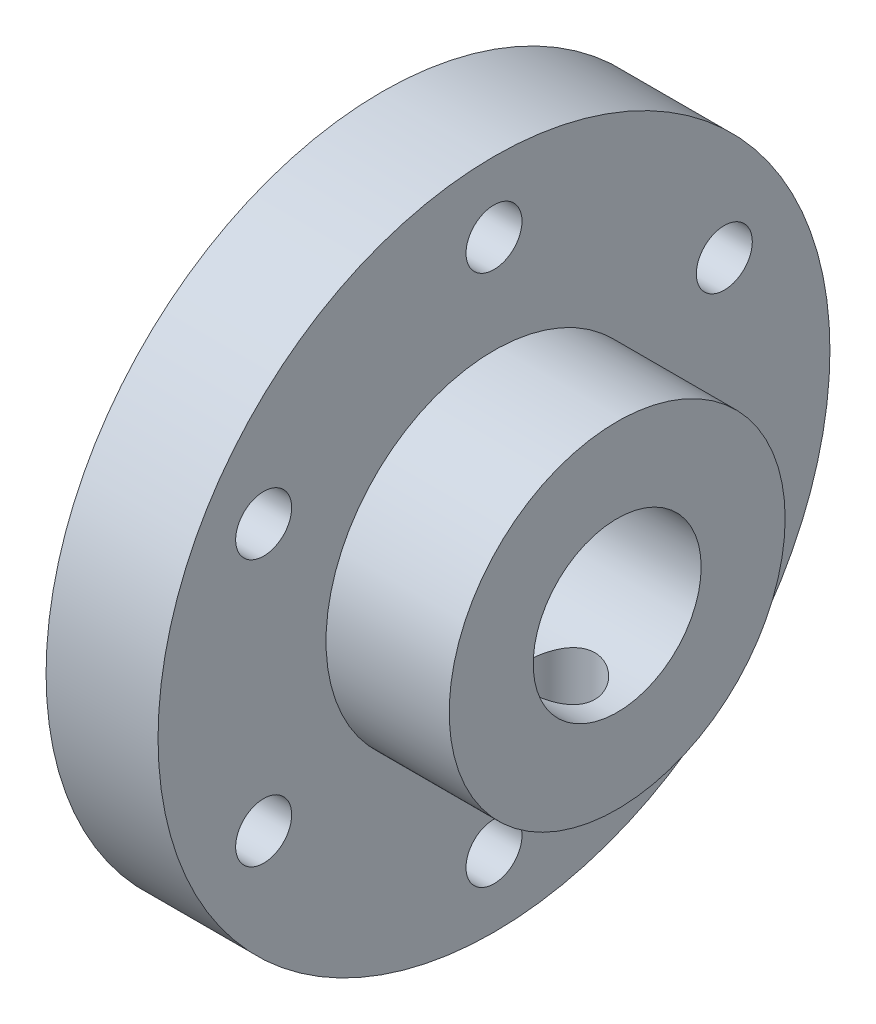
from build123d import *

# Parameters (mm, degrees)
SKETCH1_R               = 30
BOSS_EXTRUDE1_DEPTH     = 10
SKETCH2_R               = 2.5
CUT_EXTRUDE1_DEPTH      = 44.588989435
SKETCH5_R               = 14
BOSS_EXTRUDE4_DEPTH     = 6
SKETCH8_R               = 15
BOSS_EXTRUDE6_DEPTH     = 1
SKETCH13_R              = 15
BOSS_EXTRUDE7_DEPTH     = 10
CUT_EXTRUDE4_REACH      = 52.289
SKETCH14_R              = 7.5
CUT_EXTRUDE3_REACH      = 60.017
CUT_EXTRUDE3_END_RADIUS = 7.5
SKETCH12_R              = 3


with BuildPart() as part:
    # Sketch1 → Boss-Extrude1 (new body)
    with BuildSketch(Plane(origin=(0, 0, 0), x_dir=(0, 0, -1), z_dir=(1, 0, 0))):
        Circle(SKETCH1_R)
    extrude(amount=BOSS_EXTRUDE1_DEPTH)

    # Sketch2 → Cut-Extrude1 (cut, through all)
    with BuildSketch(Plane(origin=(10, 0, 0), x_dir=(0, 0, -1), z_dir=(1, 0, 0))):
        with Locations((0, 23.75)):
            Circle(SKETCH2_R)
        with Locations((20.56810334, 11.875)):
            Circle(SKETCH2_R)
        with Locations((20.56810334, -11.875)):
            Circle(SKETCH2_R)
        with Locations((0, -23.75)):
            Circle(SKETCH2_R)
        with Locations((-20.56810334, -11.875)):
            Circle(SKETCH2_R)
        with Locations((-20.56810334, 11.875)):
            Circle(SKETCH2_R)
    extrude(amount=-CUT_EXTRUDE1_DEPTH, mode=Mode.SUBTRACT)

    # Sketch5 → Boss-Extrude4 (add)
    with BuildSketch(Plane.ZY):
        with Locations(Location((0, 0, 0), (0, 0, 180))):
            Circle(SKETCH5_R)
    extrude(amount=BOSS_EXTRUDE4_DEPTH)

    # Sketch8 → Boss-Extrude6 (add)
    with BuildSketch(Plane(origin=(10, 0, 0), x_dir=(0, 0, -1), z_dir=(1, 0, 0))):
        Circle(SKETCH8_R)
    extrude(amount=BOSS_EXTRUDE6_DEPTH)

    # Sketch13 → Boss-Extrude7 (add)
    with BuildSketch(Plane(origin=(11, 0, 0), x_dir=(0, 0, -1), z_dir=(1, 0, 0))):
        Circle(SKETCH13_R)
    extrude(amount=BOSS_EXTRUDE7_DEPTH)

    # Sketch14 → Cut-Extrude4 (cut, up to next)
    with BuildSketch(Plane(origin=(21, 0, 0), x_dir=(0, 0, -1), z_dir=(1, 0, 0)), mode=Mode.PRIVATE) as cut_extrude4_sk1:
        Circle(SKETCH14_R)
    cut_extrude4_tool1 = extrude(cut_extrude4_sk1.sketch, amount=-CUT_EXTRUDE4_REACH, mode=Mode.PRIVATE) & part.part
    add(cut_extrude4_tool1.solids().sort_by_distance((21, 0, 0))[0], mode=Mode.SUBTRACT)

    # Cut-Extrude3: up to this cylinder (the profile starts outside it)
    cut_extrude3_end = Plane(origin=(16, 0, 0), z_dir=(1, 0, 0)) * Cylinder(CUT_EXTRUDE3_END_RADIUS, 136.034, mode=Mode.PRIVATE)
    # Sketch12 → Cut-Extrude3 (cut, up to the surface)
    with BuildSketch(Plane(origin=(0, -15, 0), x_dir=(-1, 0, 0), z_dir=(0, -1, 0)), mode=Mode.PRIVATE) as cut_extrude3_sk1:
        with Locations(Location((-16, 0, 0), (0, 0, 90))):
            Circle(SKETCH12_R)
    cut_extrude3_tool1 = extrude(cut_extrude3_sk1.sketch, amount=-CUT_EXTRUDE3_REACH, mode=Mode.PRIVATE) - cut_extrude3_end
    add(cut_extrude3_tool1.solids().sort_by_distance((16, -15, 0))[0], mode=Mode.SUBTRACT)


solid = part.part
